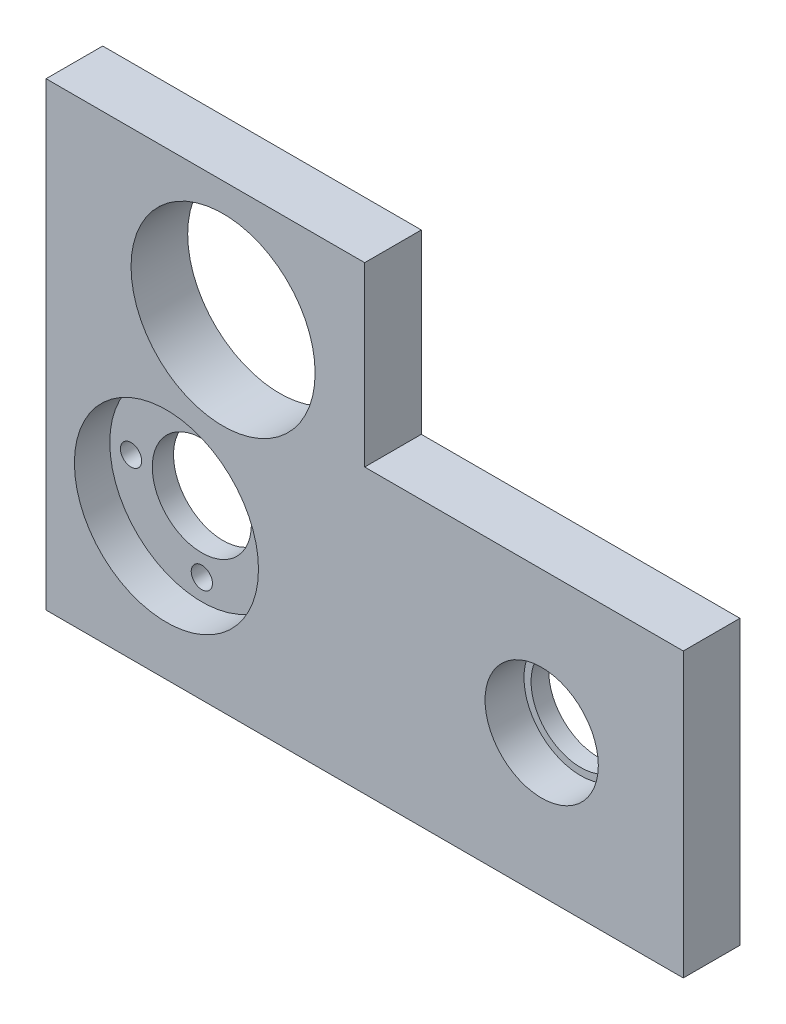
from build123d import *

# Parameters (mm, degrees)
ESQUISSE1_W             = 90
ESQUISSE1_H             = 65
ESQUISSE1_R             = 7
ESQUISSE1_R_2           = 13
BOSS_EXTRU_1_DEPTH      = 8
ESQUISSE2_R             = 13
BOSS_EXTRU_2_DEPTH      = 3
ESQUISSE3_R             = 7
ESQUISSE3_R_2           = 1.5
ENL_V_MAT_EXTRU_1_DEPTH = 112.130553854
ESQUISSE4_R             = 8
ENL_V_MAT_EXTRU_2_DEPTH = 5.5
ESQUISSE5_W             = 45
ESQUISSE5_H             = 25
ENL_V_MAT_EXTRU_3_DEPTH = 112.30588484


with BuildPart() as part:
    # Esquisse1 → Boss.-Extru.1 (new body)
    with BuildSketch(Plane.XY):
        with Locations((45, 32.5)):
            Rectangle(ESQUISSE1_W, ESQUISSE1_H)
        with Locations((70, 20)):
            Circle(ESQUISSE1_R, mode=Mode.SUBTRACT)
        with Locations((17, 20)):
            Circle(ESQUISSE1_R_2, mode=Mode.SUBTRACT)
        with Locations((25, 48)):
            Circle(ESQUISSE1_R_2, mode=Mode.SUBTRACT)
    extrude(amount=BOSS_EXTRU_1_DEPTH)

    # Esquisse2 → Boss.-Extru.2 (add)
    with BuildSketch(Plane(origin=(0, 0, 0), x_dir=(-1, 0, 0), z_dir=(0, 0, -1))):
        with Locations((-17, 20)):
            Circle(ESQUISSE2_R)
    extrude(amount=-BOSS_EXTRU_2_DEPTH)

    # Esquisse3 → Enlèv. mat.-Extru.1 (cut, through all)
    with BuildSketch(Plane.XY.offset(3)):
        with Locations((17, 20)):
            Circle(ESQUISSE3_R)
        with Locations((27, 20)):
            Circle(ESQUISSE3_R_2)
        with Locations((17, 10)):
            Circle(ESQUISSE3_R_2)
        with Locations((7, 20)):
            Circle(ESQUISSE3_R_2)
        with Locations((17, 30)):
            Circle(ESQUISSE3_R_2)
    extrude(amount=-ENL_V_MAT_EXTRU_1_DEPTH, mode=Mode.SUBTRACT)

    # Esquisse4 → Enlèv. mat.-Extru.2 (cut)
    with BuildSketch(Plane.XY.offset(8)):
        with Locations((70, 20)):
            Circle(ESQUISSE4_R)
    extrude(amount=-ENL_V_MAT_EXTRU_2_DEPTH, mode=Mode.SUBTRACT)

    # Esquisse5 → Enlèv. mat.-Extru.3 (cut, through all)
    with BuildSketch(Plane.XY.offset(8)):
        with Locations((67.5, 52.5)):
            Rectangle(ESQUISSE5_W, ESQUISSE5_H)
    extrude(amount=-ENL_V_MAT_EXTRU_3_DEPTH, mode=Mode.SUBTRACT)


solid = part.part
